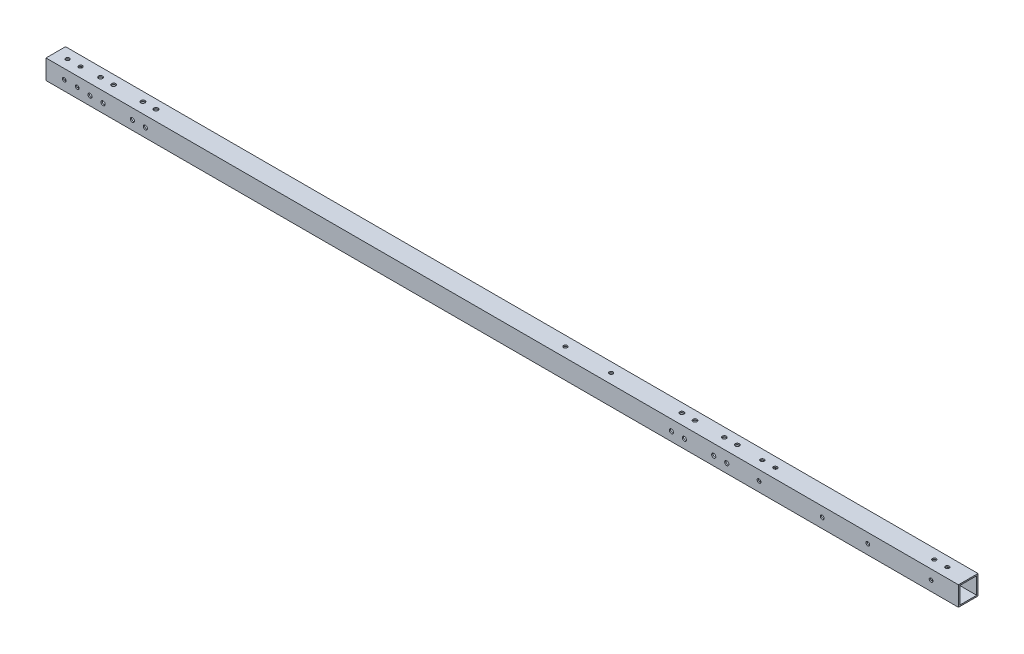
from build123d import *

# Parameters (mm, degrees)
SKETCH_1_W          = 15
SKETCH_1_H          = 15
SKETCH_1_W_2        = 13
SKETCH_1_H_2        = 13
EXTRUDE_1_DEPTH     = 700
SKETCH_3_R          = 1.45
SKETCH_3_R_2        = 1.6
CUT_EXTRUDE_1_DEPTH = 701.200864038
SKETCH_4_R          = 1.45
SKETCH_4_R_2        = 1.6
CUT_EXTRUDE_2_DEPTH = 701.200864038


with BuildPart() as part:
    # 草图1 → 凸台-拉伸1 (new body)
    with BuildSketch(Plane(origin=(0, 0, 0), x_dir=(0, 0, -1), z_dir=(1, 0, 0))):
        Rectangle(SKETCH_1_W, SKETCH_1_H)
        Rectangle(SKETCH_1_W_2, SKETCH_1_H_2, mode=Mode.SUBTRACT)
    extrude(amount=EXTRUDE_1_DEPTH)

    # 草图3 → 切除-拉伸1 (cut, through all)
    with BuildSketch(Plane.XY.offset(7.5)):
        with Locations((595.5, 0)):
            Circle(SKETCH_3_R)
        with Locations((24, 0)):
            Circle(SKETCH_3_R)
        with Locations((14, 0)):
            Circle(SKETCH_3_R)
        with Locations((76.25, -0.621320344)):
            Circle(SKETCH_3_R_2)
        with Locations((66.25, -0.621320344)):
            Circle(SKETCH_3_R_2)
        with Locations((43.75, -0.621320344)):
            Circle(SKETCH_3_R_2)
        with Locations((33.75, -0.621320344)):
            Circle(SKETCH_3_R_2)
        with Locations((522.25, -0.621320344)):
            Circle(SKETCH_3_R_2)
        with Locations((512.25, -0.621320344)):
            Circle(SKETCH_3_R_2)
        with Locations((489.75, -0.621320344)):
            Circle(SKETCH_3_R_2)
        with Locations((479.75, -0.621320344)):
            Circle(SKETCH_3_R_2)
        with Locations((630.5, 0)):
            Circle(SKETCH_3_R)
        with Locations((547, 0)):
            Circle(SKETCH_3_R)
        with Locations((679, 0)):
            Circle(SKETCH_3_R)
    extrude(amount=-CUT_EXTRUDE_1_DEPTH, mode=Mode.SUBTRACT)

    # 草图4 → 切除-拉伸2 (cut, through all)
    with BuildSketch(Plane(origin=(0, 7.5, 0), x_dir=(1, 0, 0), z_dir=(0, 1, 0))):
        with Locations(Location((9, 0, 0), (0, 0, 270))):
            Circle(SKETCH_4_R)
        with Locations(Location((33.75, 0.621320344, 0), (0, 0, 270))):
            Circle(SKETCH_4_R_2)
        with Locations(Location((43.75, 0.621320344, 0), (0, 0, 270))):
            Circle(SKETCH_4_R_2)
        with Locations(Location((76.25, 0.621320344, 0), (0, 0, 270))):
            Circle(SKETCH_4_R_2)
        with Locations(Location((66.25, 0.621320344, 0), (0, 0, 270))):
            Circle(SKETCH_4_R_2)
        with Locations(Location((426, 0, 0), (0, 0, 270))):
            Circle(SKETCH_4_R)
        with Locations(Location((391, 0, 0), (0, 0, 270))):
            Circle(SKETCH_4_R)
        with Locations(Location((512.25, 0.621320344, 0), (0, 0, 270))):
            Circle(SKETCH_4_R_2)
        with Locations(Location((489.75, 0.621320344, 0), (0, 0, 270))):
            Circle(SKETCH_4_R_2)
        with Locations(Location((479.75, 0.621320344, 0), (0, 0, 270))):
            Circle(SKETCH_4_R_2)
        with Locations(Location((522.25, 0.621320344, 0), (0, 0, 270))):
            Circle(SKETCH_4_R_2)
        with Locations(Location((552, 0, 0), (0, 0, 270))):
            Circle(SKETCH_4_R)
        with Locations(Location((674, 0, 0), (0, 0, 270))):
            Circle(SKETCH_4_R)
        with Locations(Location((684, 0, 0), (0, 0, 270))):
            Circle(SKETCH_4_R)
        with Locations(Location((19, 0, 0), (0, 0, 270))):
            Circle(SKETCH_4_R)
        with Locations(Location((542, 0, 0), (0, 0, 270))):
            Circle(SKETCH_4_R)
    extrude(amount=-CUT_EXTRUDE_2_DEPTH, mode=Mode.SUBTRACT)


solid = part.part
